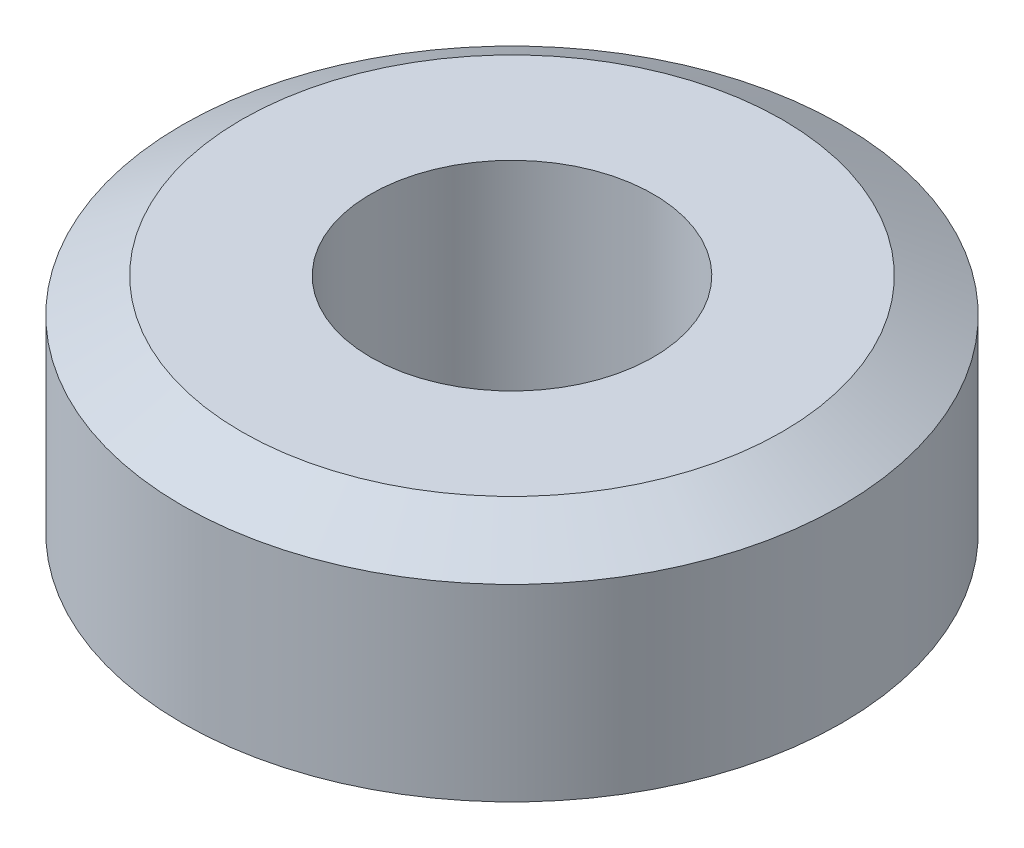
from build123d import *

# Parameters (mm, degrees)
SKETCH_1_R       = 3.85
SKETCH_1_R_2     = 1.65
EXTRUDE_1_DEPTH  = 3
CHAMFER_8_SIZE   = 0.4
CHAMFER_8_SIZE2  = 0.692820323
CHAMFER_10_SIZE  = 0.4
CHAMFER_10_SIZE2 = 0.692820323


with BuildPart() as part:
    # Эскиз1 → Бобышка-Вытянуть1 (new body)
    with BuildSketch(Plane(origin=(0, 0, 0), x_dir=(1, 0, 0), z_dir=(0, 1, 0))):
        with Locations(Location((0, 0, 0), (0, 0, 270))):
            Circle(SKETCH_1_R)
        with Locations(Location((0, 0, 0), (0, 0, 270))):
            Circle(SKETCH_1_R_2, mode=Mode.SUBTRACT)
    extrude(amount=EXTRUDE_1_DEPTH)

    # Фаска8
    chamfer_8_edges = [part.edges().sort_by_distance(p)[0] for p in [
        (0, 3, -3.85),
    ]]
    chamfer_8_side = [part.faces().sort_by_distance(p)[0] for p in [
        (0, 1.5, -3.85),
    ]]
    chamfer(chamfer_8_edges, length=CHAMFER_8_SIZE, length2=CHAMFER_8_SIZE2, reference=chamfer_8_side[0])

    # Фаска10
    chamfer_10_edges = [part.edges().sort_by_distance(p)[0] for p in [
        (0, 0, -3.85),
    ]]
    chamfer_10_side = [part.faces().sort_by_distance(p)[0] for p in [
        (0, 1.3, -3.85),
    ]]
    chamfer(chamfer_10_edges, length=CHAMFER_10_SIZE, length2=CHAMFER_10_SIZE2, reference=chamfer_10_side[0])


solid = part.part
